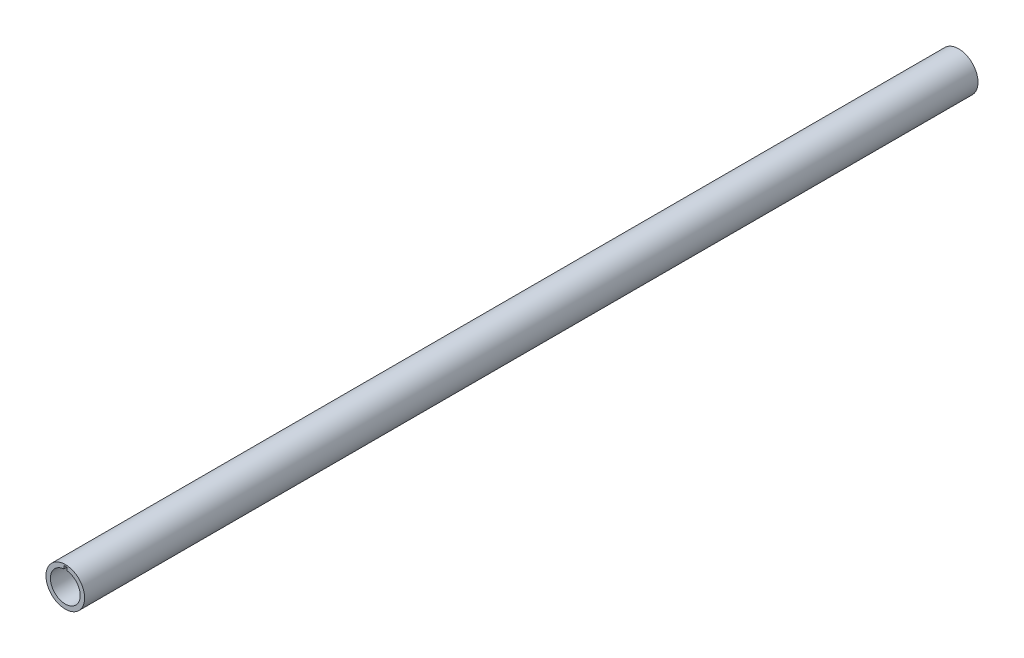
from build123d import *

# Parameters (mm, degrees)
SKETCH1_R           = 13
SKETCH1_R_2         = 10
BOSS_EXTRUDE1_DEPTH = 600
CUT_EXTRUDE1_START  = -20
CUT_EXTRUDE1_DEPTH  = 20
CUT_EXTRUDE2_DEPTH  = 20


with BuildPart() as part:
    # Sketch1 → Boss-Extrude1 (new body)
    with BuildSketch(Plane.XY):
        Circle(SKETCH1_R)
        Circle(SKETCH1_R_2, mode=Mode.SUBTRACT)
    extrude(amount=BOSS_EXTRUDE1_DEPTH)

    # Sketch2 → Cut-Extrude1 (cut)
    with BuildSketch(Plane.XY.offset(600).offset(CUT_EXTRUDE1_START)):
        with BuildLine():
            Line((-1, 9.949874371), (-1, 12))
            Line((-1, 12), (1, 12))
            Line((1, 12), (1, 9.949874371))
            ThreePointArc((1, 9.949874371), (0, 10), (-1, 9.949874371))
        make_face()
    extrude(amount=CUT_EXTRUDE1_DEPTH, mode=Mode.SUBTRACT)

    # Sketch3 → Cut-Extrude2 (cut)
    with BuildSketch(Plane(origin=(0, 0, 0), x_dir=(-1, 0, 0), z_dir=(0, 0, -1))):
        with BuildLine():
            Line((-1, 9.949874371), (-1, 11.949874371))
            Line((-1, 11.949874371), (1, 11.949874371))
            Line((1, 11.949874371), (1, 9.949874371))
            ThreePointArc((1, 9.949874371), (0, 10), (-1, 9.949874371))
        make_face()
    extrude(amount=-CUT_EXTRUDE2_DEPTH, mode=Mode.SUBTRACT)


solid = part.part
